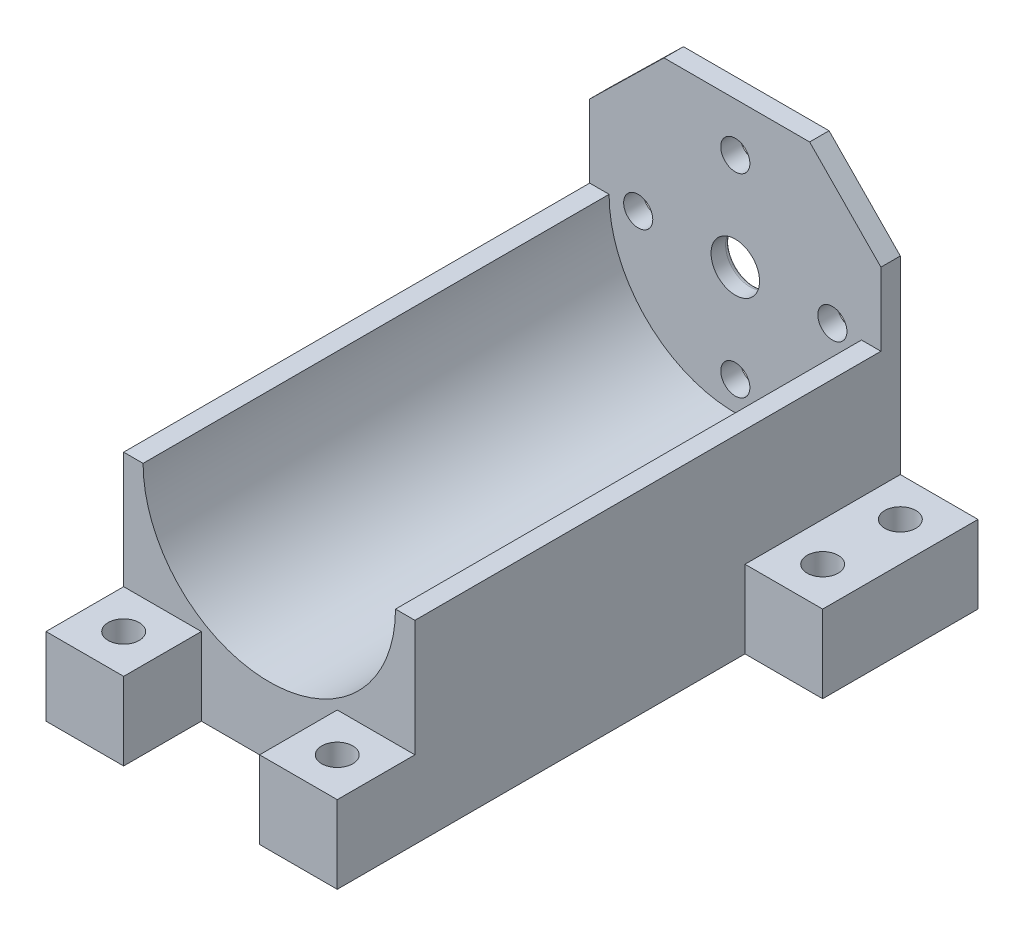
from build123d import *

# Parameters (mm, degrees)
ESQUISSE1_R        = 1.5
ESQUISSE1_R_2      = 2.5
BOSS_EXTRU_1_DEPTH = 2
BOSS_EXTRU_2_DEPTH = 50
CONG_1_R           = 0.5
ESQUISSE3_W        = 8
ESQUISSE3_H        = 8
ESQUISSE3_R        = 1.6
BOSS_EXTRU_4_DEPTH = 8


with BuildPart() as part:
    # Esquisse1 → Boss.-Extru.1 (new body)
    with BuildSketch(Plane.XY):
        with BuildLine():
            Line((-7.341000528, 15), (-15, 7.5))
            Line((-15, 7.5), (-15, 0))
            Line((-15, 0), (-13, 0))
            ThreePointArc((-13, 0), (0, -13), (13, 0))
            Line((13, 0), (15, 0))
            Line((15, 0), (15, 7.5))
            Line((15, 7.5), (7.658999472, 15))
            Line((7.658999472, 15), (-7.341000528, 15))
        make_face()
        with Locations((0, 10)):
            Circle(ESQUISSE1_R, mode=Mode.SUBTRACT)
        with Locations((-10, 0)):
            Circle(ESQUISSE1_R, mode=Mode.SUBTRACT)
        with Locations((0, -10)):
            Circle(ESQUISSE1_R, mode=Mode.SUBTRACT)
        Circle(ESQUISSE1_R_2, mode=Mode.SUBTRACT)
        with Locations((10, 0)):
            Circle(ESQUISSE1_R, mode=Mode.SUBTRACT)
    extrude(amount=BOSS_EXTRU_1_DEPTH)

    # Esquisse2 → Boss.-Extru.2 (add)
    with BuildSketch(Plane(origin=(0, 0, 0), x_dir=(-1, 0, 0), z_dir=(0, 0, -1))):
        with BuildLine():
            ThreePointArc((13, 0), (9.192388155, -9.192388155), (0, -13))
            Line((0, -13), (0, -15))
            ThreePointArc((0, -15), (10.606601718, -10.606601718), (15, 0))
            Line((15, 0), (13, 0))
        make_face()
        with BuildLine():
            Line((0, -15), (0, -13))
            ThreePointArc((0, -13), (-9.192388155, -9.192388155), (-13, 0))
            Line((-13, 0), (-15, 0))
            ThreePointArc((-15, 0), (-10.606601718, -10.606601718), (0, -15))
        make_face()
        with BuildLine():
            Line((0, -20), (0, -15))
            ThreePointArc((0, -15), (-10.606601718, -10.606601718), (-15, 0))
            Line((-15, 0), (-15, -20))
            Line((-15, -20), (0, -20))
        make_face()
        with BuildLine():
            ThreePointArc((15, 0), (10.606601718, -10.606601718), (0, -15))
            Line((0, -15), (0, -20))
            Line((0, -20), (15, -20))
            Line((15, -20), (15, 0))
        make_face()
    extrude(amount=-BOSS_EXTRU_2_DEPTH)

    # Congé1
    cong_1_edges = [part.edges().sort_by_distance(p)[0] for p in [
        (-2.5, 0, 0),
    ]]
    fillet(cong_1_edges, radius=CONG_1_R)

    # Esquisse3 → Boss.-Extru.4 (add)
    # profile 1 of 4: a face of its own
    with BuildSketch(Plane.XZ.offset(20)):
        with Locations((19, 12)):
            Rectangle(ESQUISSE3_W, ESQUISSE3_H)
        with Locations(Location((19, 12, 0), (0, 0, 270))):
            Circle(ESQUISSE3_R, mode=Mode.SUBTRACT)
    # profile 2 of 4: a face of its own
    with BuildSketch(Plane.XZ.offset(20)):
        with Locations((19, 4)):
            Rectangle(ESQUISSE3_W, ESQUISSE3_H)
        with Locations(Location((19, 4, 0), (0, 0, 270))):
            Circle(ESQUISSE3_R, mode=Mode.SUBTRACT)
    # profile 3 of 4: a face of its own
    with BuildSketch(Plane.XZ.offset(20)):
        with Locations((11, 54)):
            Rectangle(ESQUISSE3_W, ESQUISSE3_H)
        with Locations(Location((11, 54, 0), (0, 0, 270))):
            Circle(ESQUISSE3_R, mode=Mode.SUBTRACT)
    # profile 4 of 4: a face of its own
    with BuildSketch(Plane.XZ.offset(20)):
        with Locations((-11, 54)):
            Rectangle(ESQUISSE3_W, ESQUISSE3_H)
        with Locations(Location((-11, 54, 0), (0, 0, 270))):
            Circle(ESQUISSE3_R, mode=Mode.SUBTRACT)
    extrude(amount=-BOSS_EXTRU_4_DEPTH)


solid = part.part
